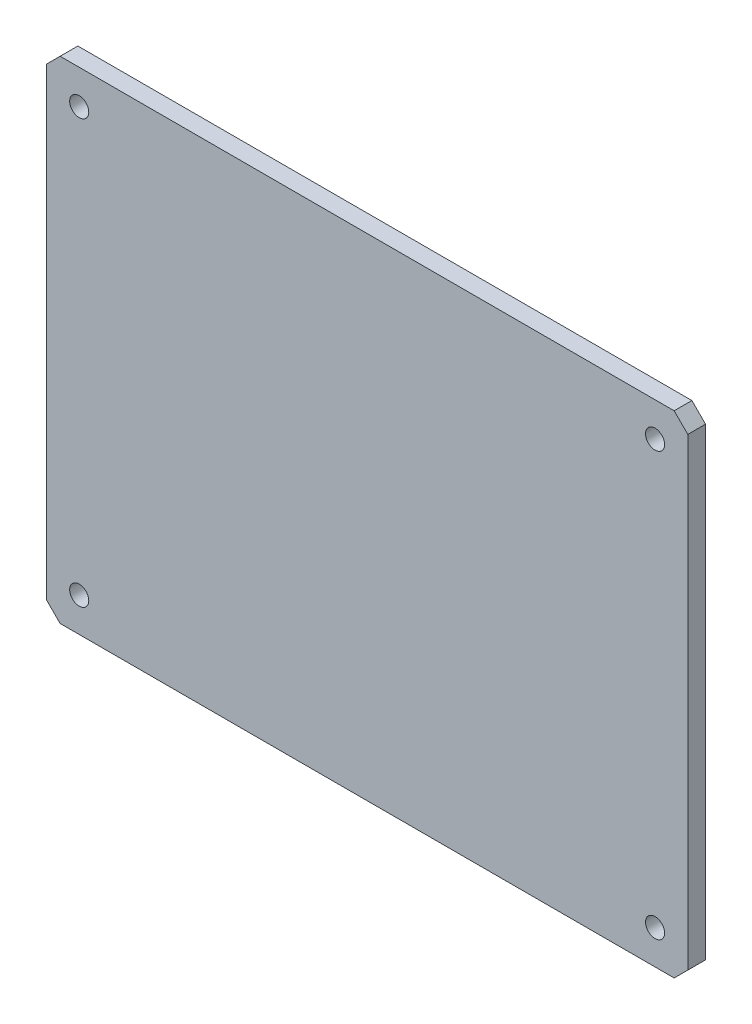
from build123d import *

# Parameters (mm, degrees)
F_2_8_PROFILE_R   = 1.4
EXTRUDE_2_8_DEPTH = 2.6


with BuildPart() as part:
    # 平盖和四个 Ø2.8 通孔 profile → 平盖和四个 Ø2.8 通孔 (new body)
    with BuildSketch(Plane.XY):
        Polygon((-45, -36), (45, -36), (47, -34), (47, 34), (45, 36), (-45, 36), (-47, 34), (-47, -34), align=None)
        with Locations((-42.2, -31)):
            Circle(F_2_8_PROFILE_R, mode=Mode.SUBTRACT)
        with Locations((42.2, -31)):
            Circle(F_2_8_PROFILE_R, mode=Mode.SUBTRACT)
        with Locations((-42.2, 31)):
            Circle(F_2_8_PROFILE_R, mode=Mode.SUBTRACT)
        with Locations((42.2, 31)):
            Circle(F_2_8_PROFILE_R, mode=Mode.SUBTRACT)
    extrude(amount=EXTRUDE_2_8_DEPTH)


solid = part.part
